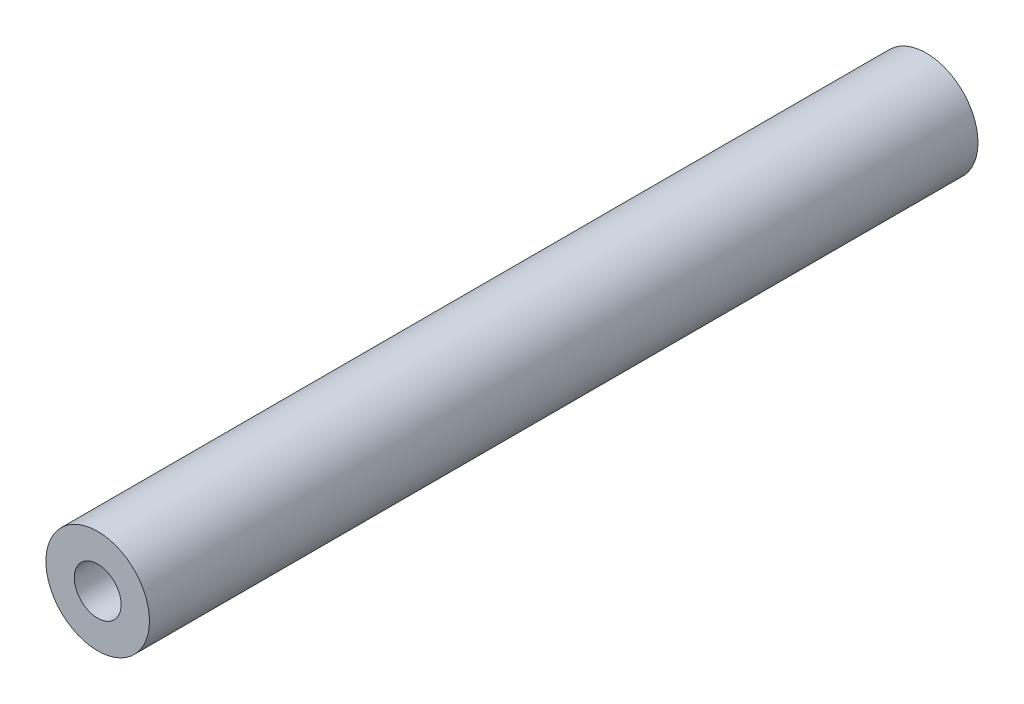
from build123d import *

# Parameters (mm, degrees)
CROQUIS1_R                     = 12.7
SALIENTE_EXTRUIR2_DEPTH        = 101.6
TALADRO_ROSCADO_1_2_201_D      = 11.50874
TALADRO_ROSCADO_1_2_201_DEPTH  = 31.75
TALADRO_ROSCADO_1_2_201_TIP    = 3.45757432
TALADRO_ROSCADO_5_16_181_D     = 6.5278
TALADRO_ROSCADO_5_16_181_DEPTH = 19.7485
TALADRO_ROSCADO_5_16_181_TIP   = 1.961148974


with BuildPart() as part:
    # Croquis1 → Saliente-Extruir2 (new, symmetric)
    with BuildSketch(Plane.XY):
        Circle(CROQUIS1_R)
    extrude(amount=SALIENTE_EXTRUIR2_DEPTH, both=True)

    # Taladro roscado 1/2-201
    with Locations(Plane.XY.offset(101.6)):
        with Locations((0, 0)):
            Hole(TALADRO_ROSCADO_1_2_201_D / 2, depth=TALADRO_ROSCADO_1_2_201_DEPTH)
            with Locations((0, 0, -(TALADRO_ROSCADO_1_2_201_DEPTH + TALADRO_ROSCADO_1_2_201_TIP / 2))):  # 118° drill point
                Cone(0, TALADRO_ROSCADO_1_2_201_D / 2, TALADRO_ROSCADO_1_2_201_TIP, mode=Mode.SUBTRACT)

    # Taladro roscado 5/16-181
    with Locations(Plane(origin=(0, 0, -101.6), x_dir=(-1, 0, 0), z_dir=(0, 0, -1))):
        with Locations((0, 0)):
            Hole(TALADRO_ROSCADO_5_16_181_D / 2, depth=TALADRO_ROSCADO_5_16_181_DEPTH)
            with Locations((0, 0, -(TALADRO_ROSCADO_5_16_181_DEPTH + TALADRO_ROSCADO_5_16_181_TIP / 2))):  # 118° drill point
                Cone(0, TALADRO_ROSCADO_5_16_181_D / 2, TALADRO_ROSCADO_5_16_181_TIP, mode=Mode.SUBTRACT)


solid = part.part
